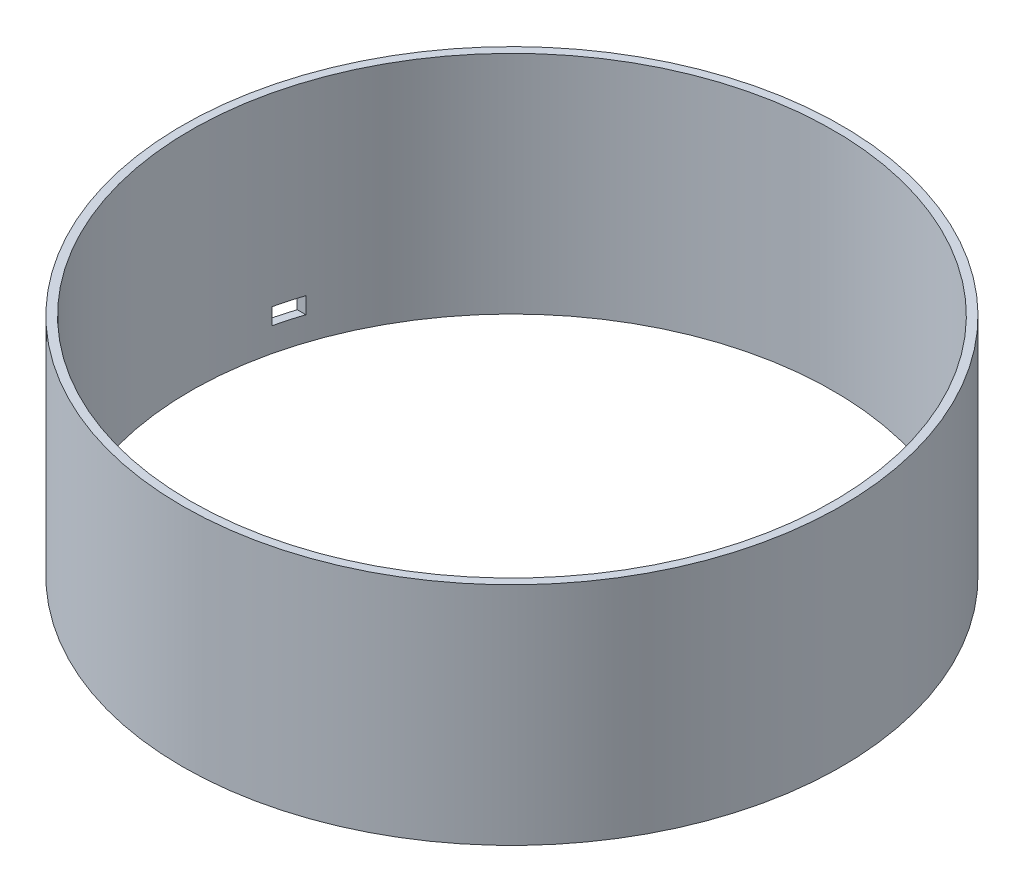
from build123d import *

# Parameters (mm, degrees)
SKETCH1_R           = 200
SKETCH1_R_2         = 195
BOSS_EXTRUDE1_DEPTH = 137
SKETCH2_W           = 16
SKETCH2_H           = 10
CUT_EXTRUDE1_DEPTH  = 70.5


with BuildPart() as part:
    # Sketch1 → Boss-Extrude1 (new body)
    with BuildSketch(Plane(origin=(0, 0, 0), x_dir=(1, 0, 0), z_dir=(0, 1, 0))):
        with Locations(Location((0, 0, 0), (0, 0, 270))):
            Circle(SKETCH1_R)
        with Locations(Location((0, 0, 0), (0, 0, 270))):
            Circle(SKETCH1_R_2, mode=Mode.SUBTRACT)
    extrude(amount=BOSS_EXTRUDE1_DEPTH)

    # Sketch2 → Cut-Extrude1 (cut, symmetric)
    with BuildSketch(Plane(origin=(-200, 0, 0), x_dir=(0, 0, -1), z_dir=(1, 0, 0))):
        with Locations((52.378156189, 19.62104378)):
            Rectangle(SKETCH2_W, SKETCH2_H)
    extrude(amount=CUT_EXTRUDE1_DEPTH, both=True, mode=Mode.SUBTRACT)


solid = part.part
